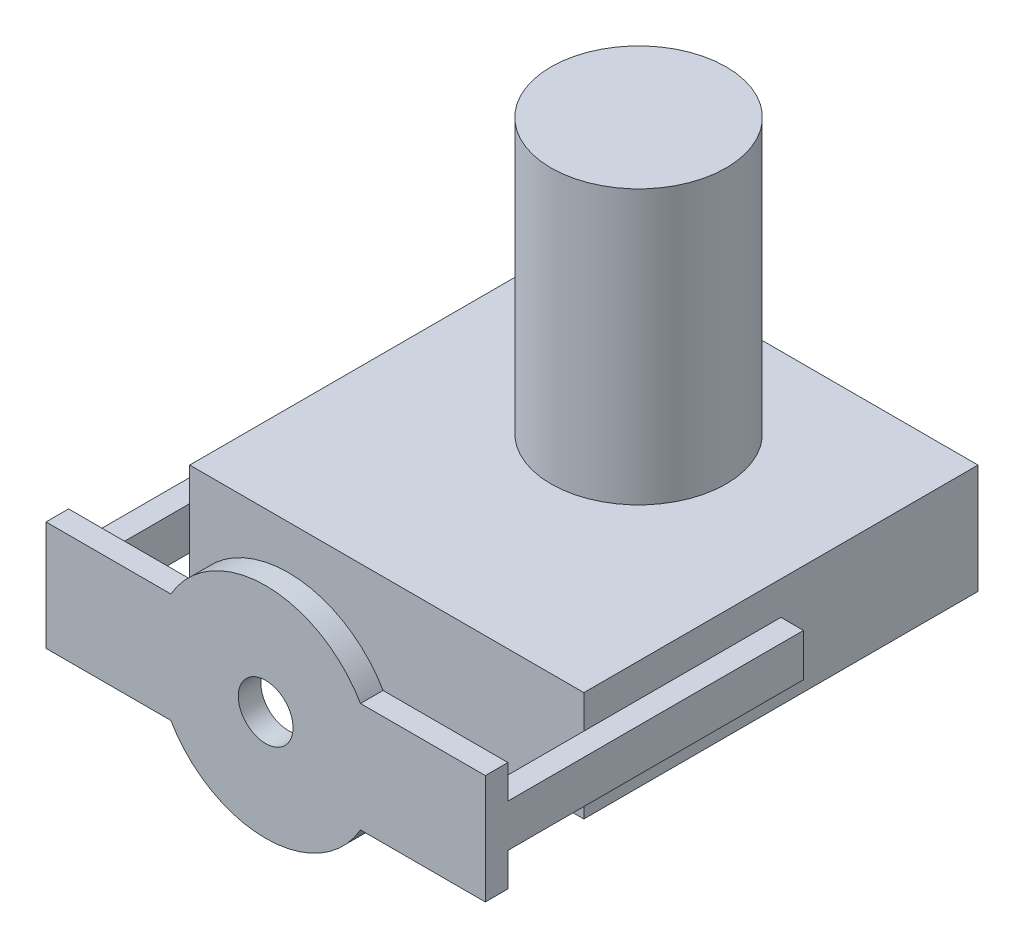
from build123d import *

# Parameters (mm, degrees)
SKETCH_1_W      = 36
SKETCH_1_H      = 36
EXTRUDE_1_DEPTH = 10
SKETCH_3_R      = 8
EXTRUDE_2_DEPTH = 25
SKETCH_4_W      = 27
SKETCH_4_H      = 3.9
EXTRUDE_3_DEPTH = 2.063094661
SKETCH_5_W      = 27
SKETCH_5_H      = 3.9
EXTRUDE_4_DEPTH = 2.063094661
SKETCH_6_R      = 2.5
EXTRUDE_5_DEPTH = 2.063094661


with BuildPart() as part:
    # 草图1 → 凸台-拉伸1 (new body)
    with BuildSketch(Plane(origin=(0, 0, 0), x_dir=(1, 0, 0), z_dir=(0, 1, 0))):
        Rectangle(SKETCH_1_W, SKETCH_1_H)
    extrude(amount=EXTRUDE_1_DEPTH)

    # 草图3 → 凸台-拉伸2 (add)
    with BuildSketch(Plane(origin=(0, 10, 0), x_dir=(1, 0, 0), z_dir=(0, 1, 0))):
        with Locations(Location((0, 5, 0), (0, 0, 270))):
            Circle(SKETCH_3_R)
    extrude(amount=EXTRUDE_2_DEPTH)

    # 草图4 → 凸台-拉伸3 (add)
    with BuildSketch(Plane.ZY.offset(18)):
        with Locations((13.5, 5)):
            Rectangle(SKETCH_4_W, SKETCH_4_H)
    extrude(amount=EXTRUDE_3_DEPTH)

    # 草图5 → 凸台-拉伸4 (add)
    with BuildSketch(Plane(origin=(18, 0, 0), x_dir=(0, 0, -1), z_dir=(1, 0, 0))):
        with Locations((-13.5, 5)):
            Rectangle(SKETCH_5_W, SKETCH_5_H)
    extrude(amount=EXTRUDE_4_DEPTH)

    # 草图6 → 凸台-拉伸5 (add)
    with BuildSketch(Plane.XY.offset(27)):
        with BuildLine():
            Line((20.063094661, 3.05), (20.063094661, 0))
            Line((20.063094661, 0), (8.660254038, 0))
            ThreePointArc((8.660254038, 0), (0, -5), (-8.660254038, 0))
            Line((-8.660254038, 0), (-20.063094661, 0))
            Line((-20.063094661, 0), (-20.063094661, 10))
            Line((-20.063094661, 10), (-8.660254038, 10))
            ThreePointArc((-8.660254038, 10), (0, 15), (8.660254038, 10))
            Line((8.660254038, 10), (20.063094661, 10))
            Line((20.063094661, 10), (20.063094661, 3.05))
        make_face()
        with Locations((0, 5)):
            Circle(SKETCH_6_R, mode=Mode.SUBTRACT)
    extrude(amount=EXTRUDE_5_DEPTH)


solid = part.part
